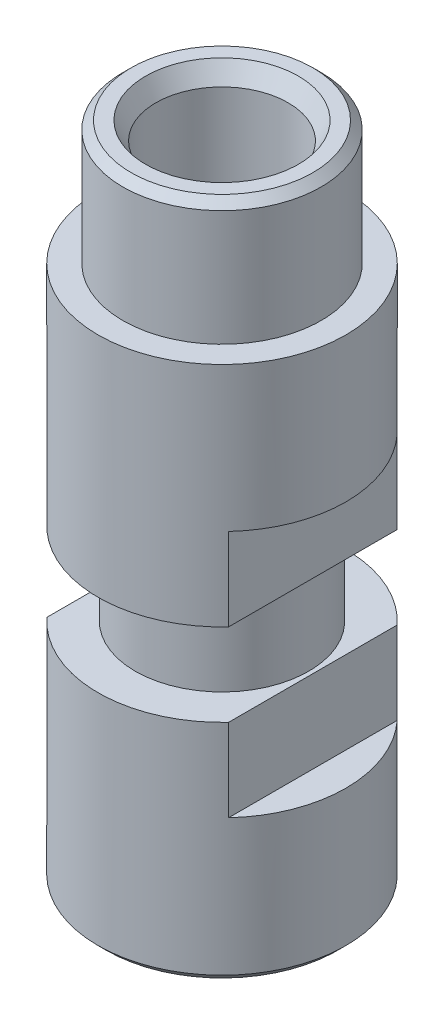
from build123d import *

# Parameters (mm, degrees)
CHAFL_N4_SIZE              = 0.2
CHAFL_N5_SIZE              = 0.25
CHAFL_N5_SIZE2             = 0.433012702
CORTAR_EXTRUIR2_DEPTH      = 17.552945357
CORTAR_EXTRUIR2_DEPTH_BACK = 17.552945357
CROQUIS4_W                 = 0.8
CROQUIS4_H                 = 6


with BuildPart() as part:
    # Croquis3 → Revolución1 (revolve)
    with BuildSketch(Plane.XY, mode=Mode.PRIVATE) as revoluci_n1_sk:
        Polygon((-1.6, 0), (-1.6, 16), (-2.4, 16), (-2.4, 13), (-3, 13), (-3, 7.5), (-2.1, 7.5), (-2.1, 5.5), (-3, 5.5), (-3, 0), align=None)
    revolve(revoluci_n1_sk.sketch.rotate(Axis((0, 0, 0), (0, 1, 0)), 270), axis=Axis((0, 0, 0), (0, 1, 0)))

    # Chaflán4
    chafl_n4_edges = [part.edges().sort_by_distance(p)[0] for p in [
        (0, 16, 2.4),
        (0, 0, 3),
    ]]
    chamfer(chafl_n4_edges, length=CHAFL_N4_SIZE)

    # Chaflán5
    chafl_n5_edges = [part.edges().sort_by_distance(p)[0] for p in [
        (0, 16, 1.6),
    ]]
    chafl_n5_side = [part.faces().sort_by_distance(p)[0] for p in [
        (0, 16, 2.137774603),
    ]]
    chamfer(chafl_n5_edges, length=CHAFL_N5_SIZE, length2=CHAFL_N5_SIZE2, reference=chafl_n5_side[0])

    # Croquis4 → Cortar-Extruir2 (cut, two sides: drawn at the far end of the back side and taken through both)
    with BuildSketch(Plane.XY.offset(-CORTAR_EXTRUIR2_DEPTH_BACK)):
        with Locations((-2.6, 6.5)):
            Rectangle(CROQUIS4_W, CROQUIS4_H)
        with Locations((2.6, 6.5)):
            Rectangle(CROQUIS4_W, CROQUIS4_H)
    extrude(amount=CORTAR_EXTRUIR2_DEPTH + CORTAR_EXTRUIR2_DEPTH_BACK, mode=Mode.SUBTRACT)


solid = part.part
